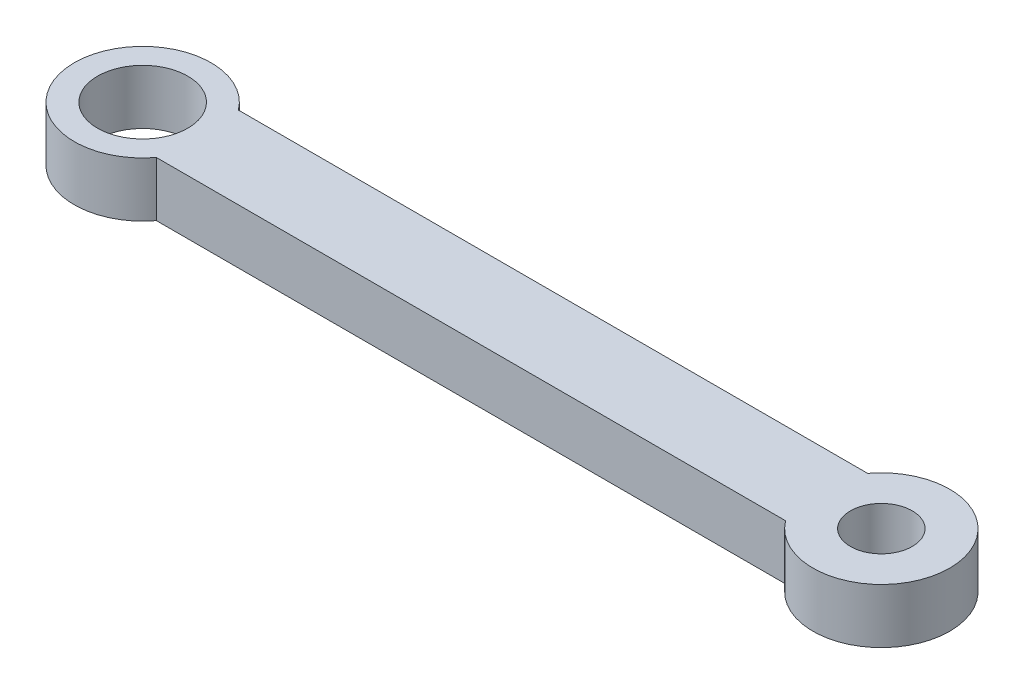
from build123d import *

# Parameters (mm, degrees)
SKETCH1_R           = 1.65
SKETCH1_R_2         = 1.1303
BOSS_EXTRUDE1_DEPTH = 2


with BuildPart() as part:
    # Sketch1 → Boss-Extrude1 (new body)
    with BuildSketch(Plane(origin=(0, 0, 0), x_dir=(1, 0, 0), z_dir=(0, 1, 0))):
        with BuildLine():
            Line((-11.5, 1.5), (11.5, 1.5))
            ThreePointArc((11.5, 1.5), (16, 0), (11.5, -1.5))
            Line((11.5, -1.5), (-11.5, -1.5))
            ThreePointArc((-11.5, -1.5), (-16, 0), (-11.5, 1.5))
        make_face()
        with Locations(Location((-13.5, 0, 0), (0, 0, 270))):
            Circle(SKETCH1_R, mode=Mode.SUBTRACT)
        with Locations(Location((13.5, 0, 0), (0, 0, 270))):
            Circle(SKETCH1_R_2, mode=Mode.SUBTRACT)
    extrude(amount=BOSS_EXTRUDE1_DEPTH)


solid = part.part
